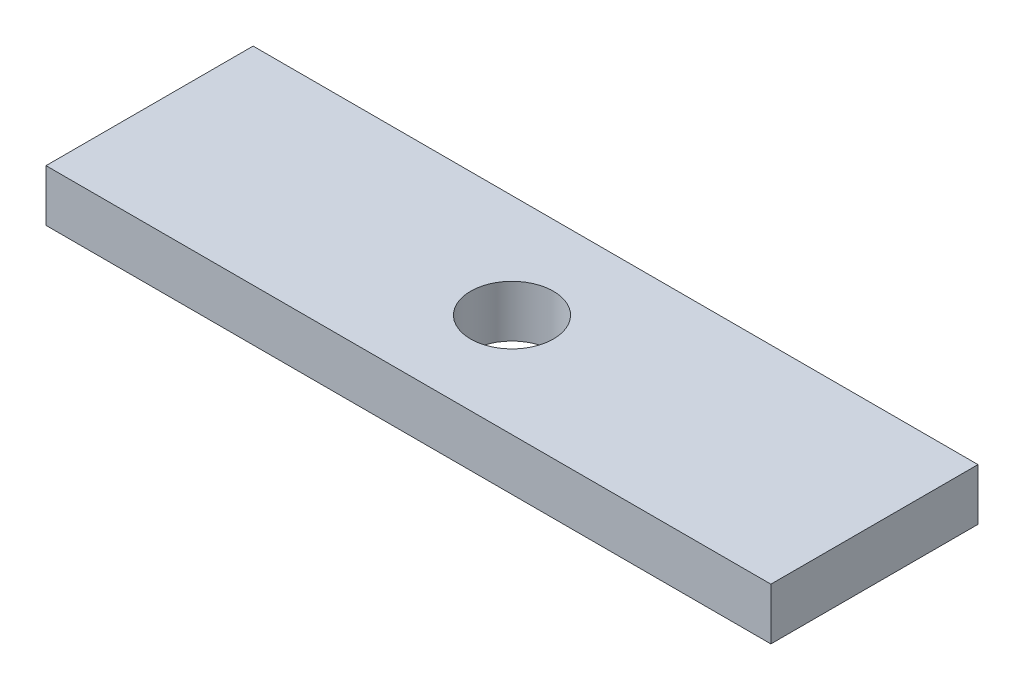
from build123d import *

# Parameters (mm, degrees)
SKETCH1_W           = 140
SKETCH1_H           = 40
SKETCH1_R           = 8
BOSS_EXTRUDE1_DEPTH = 5


with BuildPart() as part:
    # Sketch1 → Boss-Extrude1 (new, symmetric)
    with BuildSketch(Plane(origin=(0, 0, 0), x_dir=(1, 0, 0), z_dir=(0, 1, 0))):
        Rectangle(SKETCH1_W, SKETCH1_H)
        with Locations(Location((0, 0, 0), (0, 0, 270))):
            Circle(SKETCH1_R, mode=Mode.SUBTRACT)
    extrude(amount=BOSS_EXTRUDE1_DEPTH, both=True)


solid = part.part
